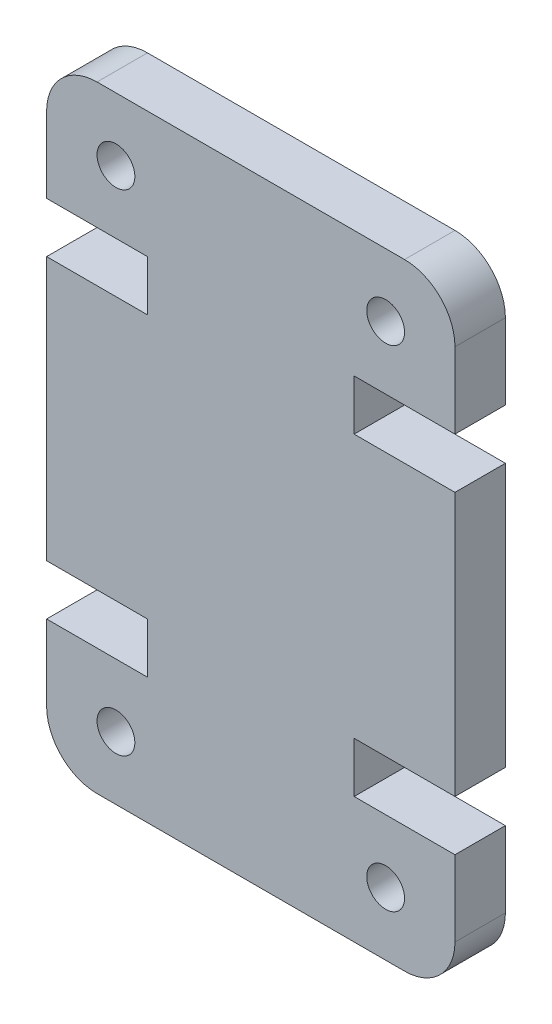
from build123d import *

# Parameters (mm, degrees)
SKETCH1_R           = 0.75
BOSS_EXTRUDE1_DEPTH = 4
SKETCH2_W           = 16.2
SKETCH2_H           = 24.45
CUT_EXTRUDE1_DEPTH  = 2


with BuildPart() as part:
    # Sketch1 → Boss-Extrude1 (new body)
    with BuildSketch(Plane.XY):
        with BuildLine():
            Line((0, 17.45), (0, 7))
            Line((0, 7), (4, 7))
            Line((4, 7), (4, 5))
            Line((4, 5), (0, 5))
            Line((0, 5), (0, 2))
            ThreePointArc((0, 2), (0.585786438, 0.585786438), (2, 0))
            Line((2, 0), (14.2, 0))
            ThreePointArc((14.2, 0), (15.614213562, 0.585786438), (16.2, 2))
            Line((16.2, 2), (16.2, 5))
            Line((16.2, 5), (12.2, 5))
            Line((12.2, 5), (12.2, 7))
            Line((12.2, 7), (16.2, 7))
            Line((16.2, 7), (16.2, 17.45))
            Line((16.2, 17.45), (12.2, 17.45))
            Line((12.2, 17.45), (12.2, 19.45))
            Line((12.2, 19.45), (16.2, 19.45))
            Line((16.2, 19.45), (16.2, 22.45))
            ThreePointArc((16.2, 22.45), (15.614213562, 23.864213562), (14.2, 24.45))
            Line((14.2, 24.45), (2, 24.45))
            ThreePointArc((2, 24.45), (0.585786438, 23.864213562), (0, 22.45))
            Line((0, 22.45), (0, 19.45))
            Line((0, 19.45), (4, 19.45))
            Line((4, 19.45), (4, 17.45))
            Line((4, 17.45), (0, 17.45))
        make_face()
        with Locations((13.45, 2.5)):
            Circle(SKETCH1_R, mode=Mode.SUBTRACT)
        with Locations((2.75, 21.95)):
            Circle(SKETCH1_R, mode=Mode.SUBTRACT)
        with Locations((2.75, 2.5)):
            Circle(SKETCH1_R, mode=Mode.SUBTRACT)
        with Locations((13.45, 21.95)):
            Circle(SKETCH1_R, mode=Mode.SUBTRACT)
    extrude(amount=BOSS_EXTRUDE1_DEPTH)

    # Sketch2 → Cut-Extrude1 (cut)
    with BuildSketch(Plane(origin=(0, 0, 0), x_dir=(-1, 0, 0), z_dir=(0, 0, -1))):
        with Locations((-8.1, 12.225)):
            Rectangle(SKETCH2_W, SKETCH2_H)
    extrude(amount=-CUT_EXTRUDE1_DEPTH, mode=Mode.SUBTRACT)


solid = part.part
